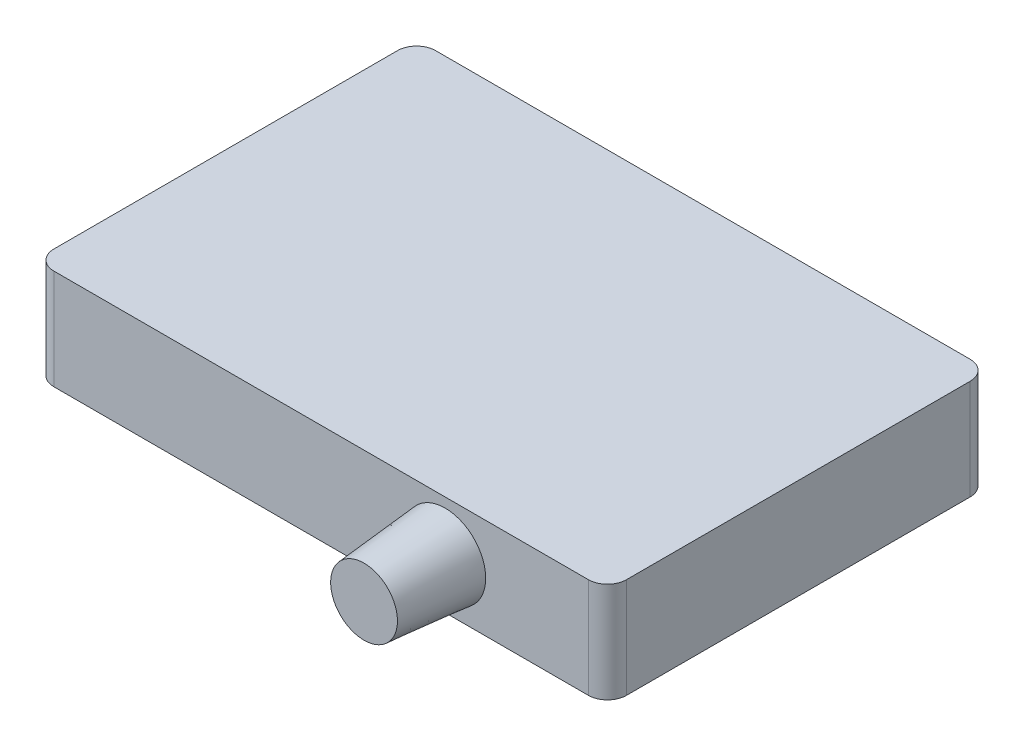
from build123d import *

# Parameters (mm, degrees)
EXTRUDE_1_DEPTH     = 10.5
SKETCH_2_R          = 2.25
CUT_EXTRUDE_1_DEPTH = 4
EXTRUDE_START       = 0.5
SKETCH_3_R          = 2.75
SKETCH_3_R_2        = 2.25
EXTRUDE_2_DEPTH     = 0.5
CHAMFER_1_SIZE      = 0.25
SKETCH_4_R          = 3.5
EXTRUDE_3_DEPTH     = 8.5
DRAFT_1_ANGLE       = 5


with BuildPart() as part:
    # 草图1 → 凸台-拉伸1 (new body)
    with BuildSketch(Plane(origin=(0, 0, 0), x_dir=(1, 0, 0), z_dir=(0, 1, 0))):
        with BuildLine():
            Line((-28, 20), (28, 20))
            ThreePointArc((28, 20), (29.414213562, 19.414213562), (30, 18))
            Line((30, 18), (30, -18))
            ThreePointArc((30, -18), (29.414213562, -19.414213562), (28, -20))
            Line((28, -20), (-28, -20))
            ThreePointArc((-28, -20), (-29.414213562, -19.414213562), (-30, -18))
            Line((-30, -18), (-30, 18))
            ThreePointArc((-30, 18), (-29.414213562, 19.414213562), (-28, 20))
        make_face()
    extrude(amount=EXTRUDE_1_DEPTH)

    # 草图2 → 切除-拉伸1 (cut)
    with BuildSketch(Plane(origin=(0, 0, -20), x_dir=(-1, 0, 0), z_dir=(0, 0, -1))):
        with Locations((-18, 4)):
            Circle(SKETCH_2_R)
        with Locations((-12, 4)):
            Circle(SKETCH_2_R)
        with Locations((-6, 4)):
            Circle(SKETCH_2_R)
    extrude(amount=-CUT_EXTRUDE_1_DEPTH, mode=Mode.SUBTRACT)

    # 草图3 → 凸台-拉伸2 (add)
    # profile 1 of 3: a face of its own
    with BuildSketch(Plane(origin=(0, 0, -20), x_dir=(-1, 0, 0), z_dir=(0, 0, -1)).offset(EXTRUDE_START)):
        with Locations(Location((-18, 4, 0), (0, 0, 180))):
            Circle(SKETCH_3_R)
        with Locations((-18, 4)):
            Circle(SKETCH_3_R_2, mode=Mode.SUBTRACT)
    # profile 2 of 3: a face of its own
    with BuildSketch(Plane(origin=(0, 0, -20), x_dir=(-1, 0, 0), z_dir=(0, 0, -1)).offset(EXTRUDE_START)):
        with Locations(Location((-12, 4, 0), (0, 0, 180))):
            Circle(SKETCH_3_R)
        with Locations((-12, 4)):
            Circle(SKETCH_3_R_2, mode=Mode.SUBTRACT)
    # profile 3 of 3: a face of its own
    with BuildSketch(Plane(origin=(0, 0, -20), x_dir=(-1, 0, 0), z_dir=(0, 0, -1)).offset(EXTRUDE_START)):
        with Locations(Location((-6, 4, 0), (0, 0, 180))):
            Circle(SKETCH_3_R)
        with Locations((-6, 4)):
            Circle(SKETCH_3_R_2, mode=Mode.SUBTRACT)
    extrude(amount=-EXTRUDE_2_DEPTH)

    # 倒角1
    chamfer_1_edges = [part.edges().sort_by_distance(p)[0] for p in [
        (15.25, 4, -20.5),
        (9.25, 4, -20.5),
        (3.25, 4, -20.5),
    ]]
    chamfer(chamfer_1_edges, length=CHAMFER_1_SIZE)

    # 草图4 → 凸台-拉伸3 (add)
    with BuildSketch(Plane.XY.offset(20)):
        with Locations(Location((13, 5.25, 0), (0, 0, 180))):
            Circle(SKETCH_4_R)
    extrude(amount=EXTRUDE_3_DEPTH)

    # 拔模1
    draft_1_faces = [part.faces().sort_by_distance(p)[0] for p in [
        (16.5, 5.25, 24.25),
    ]]
    draft(draft_1_faces, Plane(origin=(13, 5.25, 28.5), x_dir=(1, 0, 0), z_dir=(0, 0, 1)), DRAFT_1_ANGLE)


solid = part.part
